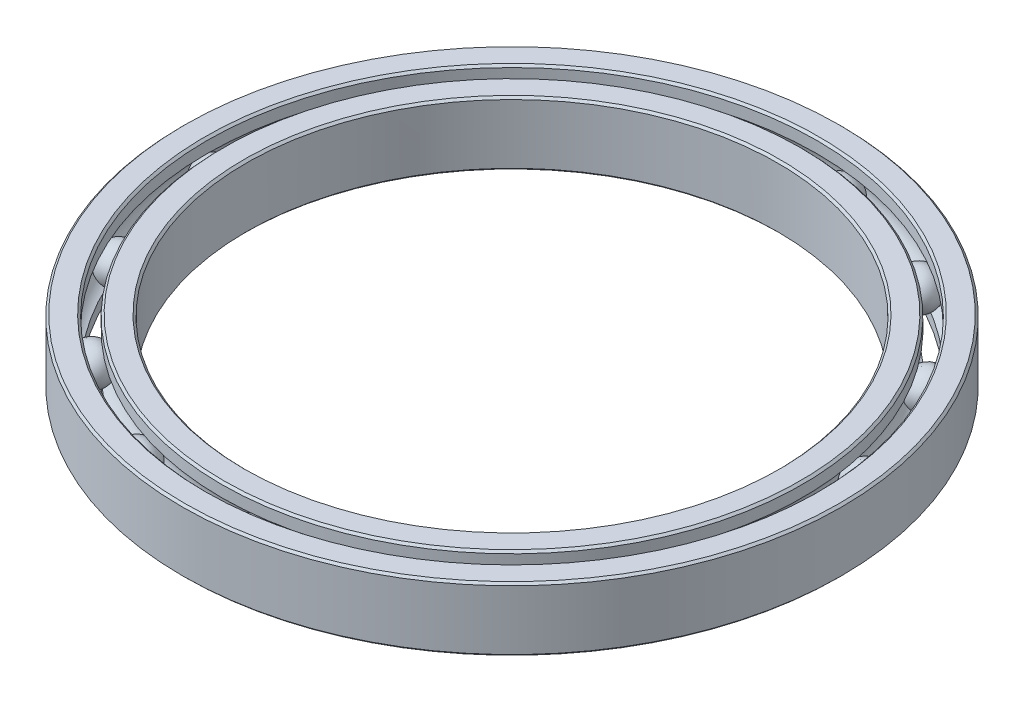
from build123d import *

# Parameters (mm, degrees)
CHAMFER1_SIZE     = 0.2
CHAMFER2_SIZE     = 0.2
CIRPATTERN2_COUNT = 15


with BuildPart() as part:
    # Sketch1 → Revolve1 (revolve)
    with BuildSketch(Plane.XY):
        with BuildLine():
            Line((-28.681365095, 0), (-31, 0))
            Line((-31, 0), (-31, 6))
            Line((-31, 6), (-28.681365095, 6))
            Line((-28.681365095, 6), (-28.681365095, 4.724309576))
            ThreePointArc((-28.681365095, 4.724309576), (-29.854050136, 3), (-28.681365095, 1.275690424))
            Line((-28.681365095, 1.275690424), (-28.681365095, 0))
        make_face()
        with BuildLine():
            Line((-25, 0), (-27.318634905, 0))
            Line((-27.318634905, 0), (-27.318634905, 1.275690424))
            ThreePointArc((-27.318634905, 1.275690424), (-26.145949864, 3), (-27.318634905, 4.724309576))
            Line((-27.318634905, 4.724309576), (-27.318634905, 6))
            Line((-27.318634905, 6), (-25, 6))
            Line((-25, 6), (-25, 0))
        make_face()
    revolve(axis=Axis((0, 0, 0), (0, -1, 0)))

    # Chamfer1
    chamfer1_edges = [part.edges().sort_by_distance(p)[0] for p in [
        (25, 0, 0),
        (25, 6, 0),
        (27.318634905, 0, 0),
        (27.318634905, 6, 0),
    ]]
    chamfer(chamfer1_edges, length=CHAMFER1_SIZE)

    # Chamfer2
    chamfer2_edges = [part.edges().sort_by_distance(p)[0] for p in [
        (31, 6, 0),
        (31, 0, 0),
        (28.681365095, 6, 0),
        (28.681365095, 0, 0),
    ]]
    chamfer(chamfer2_edges, length=CHAMFER2_SIZE)


with BuildPart() as body_2:
    # Sketch2 → Revolve2 (revolve)
    with BuildSketch(Plane.XY):
        with BuildLine():
            Line((-29.823555732, 3), (-26.176444268, 3))
            ThreePointArc((-26.176444268, 3), (-28, 4.823555732), (-29.823555732, 3))
        make_face()
    revolve(axis=Axis((-31, 3, 0), (1, 0, 0)))


with BuildPart() as cirpattern2_1:
    # CirPattern2: pattern copy
    add(body_2.part.rotate(Axis((0, 0, 0), (0, 1, 0)), 1 * 360 / CIRPATTERN2_COUNT))


with BuildPart() as cirpattern2_2:
    # CirPattern2: pattern copy
    add(body_2.part.rotate(Axis((0, 0, 0), (0, 1, 0)), 2 * 360 / CIRPATTERN2_COUNT))


with BuildPart() as cirpattern2_3:
    # CirPattern2: pattern copy
    add(body_2.part.rotate(Axis((0, 0, 0), (0, 1, 0)), 3 * 360 / CIRPATTERN2_COUNT))


with BuildPart() as cirpattern2_4:
    # CirPattern2: pattern copy
    add(body_2.part.rotate(Axis((0, 0, 0), (0, 1, 0)), 4 * 360 / CIRPATTERN2_COUNT))


with BuildPart() as cirpattern2_5:
    # CirPattern2: pattern copy
    add(body_2.part.rotate(Axis((0, 0, 0), (0, 1, 0)), 5 * 360 / CIRPATTERN2_COUNT))


with BuildPart() as cirpattern2_6:
    # CirPattern2: pattern copy
    add(body_2.part.rotate(Axis((0, 0, 0), (0, 1, 0)), 6 * 360 / CIRPATTERN2_COUNT))


with BuildPart() as cirpattern2_7:
    # CirPattern2: pattern copy
    add(body_2.part.rotate(Axis((0, 0, 0), (0, 1, 0)), 7 * 360 / CIRPATTERN2_COUNT))


with BuildPart() as cirpattern2_8:
    # CirPattern2: pattern copy
    add(body_2.part.rotate(Axis((0, 0, 0), (0, 1, 0)), 8 * 360 / CIRPATTERN2_COUNT))


with BuildPart() as cirpattern2_9:
    # CirPattern2: pattern copy
    add(body_2.part.rotate(Axis((0, 0, 0), (0, 1, 0)), 9 * 360 / CIRPATTERN2_COUNT))


with BuildPart() as cirpattern2_10:
    # CirPattern2: pattern copy
    add(body_2.part.rotate(Axis((0, 0, 0), (0, 1, 0)), 10 * 360 / CIRPATTERN2_COUNT))


with BuildPart() as cirpattern2_11:
    # CirPattern2: pattern copy
    add(body_2.part.rotate(Axis((0, 0, 0), (0, 1, 0)), 11 * 360 / CIRPATTERN2_COUNT))


with BuildPart() as cirpattern2_12:
    # CirPattern2: pattern copy
    add(body_2.part.rotate(Axis((0, 0, 0), (0, 1, 0)), 12 * 360 / CIRPATTERN2_COUNT))


with BuildPart() as cirpattern2_13:
    # CirPattern2: pattern copy
    add(body_2.part.rotate(Axis((0, 0, 0), (0, 1, 0)), 13 * 360 / CIRPATTERN2_COUNT))


with BuildPart() as cirpattern2_14:
    # CirPattern2: pattern copy
    add(body_2.part.rotate(Axis((0, 0, 0), (0, 1, 0)), 14 * 360 / CIRPATTERN2_COUNT))


solid = Compound([part.part, body_2.part, cirpattern2_1.part, cirpattern2_2.part, cirpattern2_3.part, cirpattern2_4.part, cirpattern2_5.part, cirpattern2_6.part, cirpattern2_7.part, cirpattern2_8.part, cirpattern2_9.part, cirpattern2_10.part, cirpattern2_11.part, cirpattern2_12.part, cirpattern2_13.part, cirpattern2_14.part])
